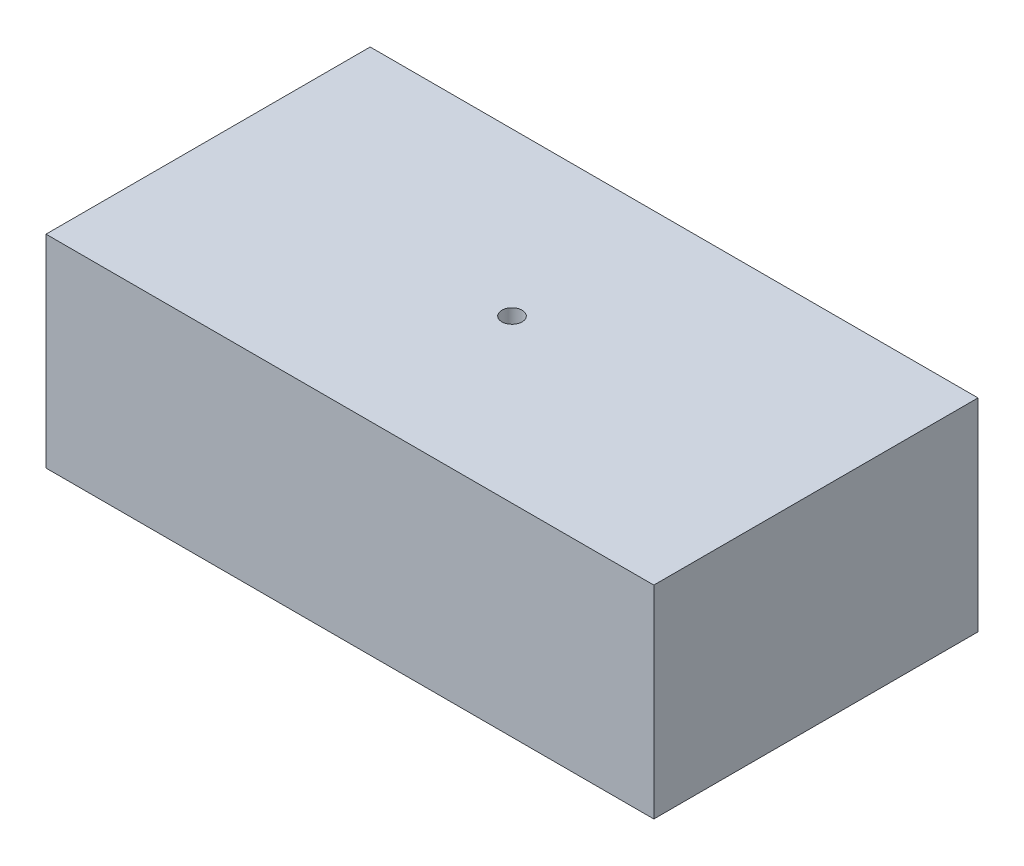
from build123d import *

# Parameters (mm, degrees)
SKETCH1_W           = 150
SKETCH1_H           = 80
BOSS_EXTRUDE4_DEPTH = 50
SKETCH2_W           = 145
SKETCH2_H           = 75
CUT_EXTRUDE12_DEPTH = 45
SKETCH3_R           = 2.5
CUT_EXTRUDE13_DEPTH = 99.615414617


with BuildPart() as part:
    # Sketch1 → Boss-Extrude4 (new body)
    with BuildSketch(Plane(origin=(0, 0, 0), x_dir=(1, 0, 0), z_dir=(0, 1, 0))):
        Rectangle(SKETCH1_W, SKETCH1_H)
    extrude(amount=BOSS_EXTRUDE4_DEPTH)

    # Sketch2 → Cut-Extrude12 (cut)
    with BuildSketch(Plane(origin=(0, 0, 0), x_dir=(1, 0, 0), z_dir=(0, 1, 0))):
        Rectangle(SKETCH2_W, SKETCH2_H)
    extrude(amount=CUT_EXTRUDE12_DEPTH, mode=Mode.SUBTRACT)

    # Sketch3 → Cut-Extrude13 (cut, through all)
    with BuildSketch(Plane(origin=(0, 0, 0), x_dir=(1, 0, 0), z_dir=(0, 1, 0))):
        with Locations(Location((0, 0, 0), (0, 0, 270))):
            Circle(SKETCH3_R)
    extrude(amount=CUT_EXTRUDE13_DEPTH, mode=Mode.SUBTRACT)


solid = part.part
